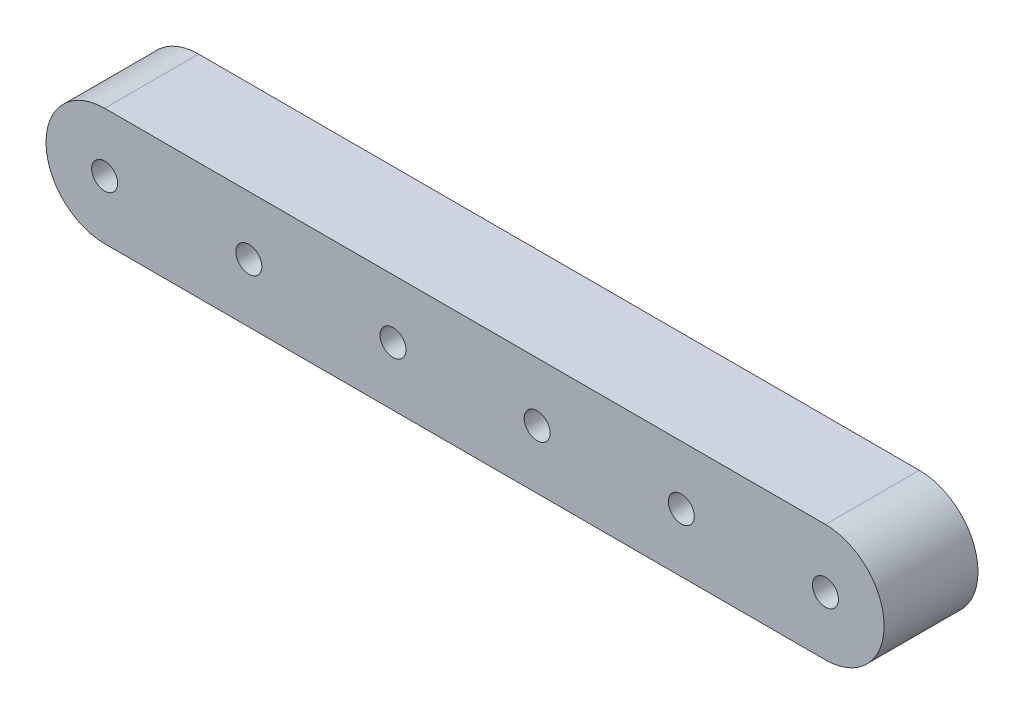
from build123d import *

# Parameters (mm, degrees)
BOSS_EXTRUDE1_DEPTH      = 2.8
BOSS_EXTRUDE1_DEPTH_BACK = 2.8
ECHELLE1_SCALE           = 2
SKETCH2_R                = 1.55
CUT_EXTRUDE6_DEPTH       = 11.2


with BuildPart() as part:
    # Sketch1 → Boss-Extrude1 (new, two sides: drawn at the far end of the back side and taken through both)
    with BuildSketch(Plane.XY.offset(-BOSS_EXTRUDE1_DEPTH_BACK)):
        with BuildLine():
            Line((-33.309608541, 3.5), (9.690391459, 3.5))
            ThreePointArc((9.690391459, 3.5), (13.190391459, 0), (9.690391459, -3.5))
            Line((9.690391459, -3.5), (-33.309608541, -3.5))
            ThreePointArc((-33.309608541, -3.5), (-36.809608541, 0), (-33.309608541, 3.5))
        make_face()
    extrude(amount=BOSS_EXTRUDE1_DEPTH + BOSS_EXTRUDE1_DEPTH_BACK)


with BuildPart() as part_1:
    # Echelle1: scaled about (-11.809608541, 0, 0)
    add(part.part.scale(ECHELLE1_SCALE).moved(Location((11.809608541, 0, 0))))

    # Sketch2 → Cut-Extrude6 (cut)
    with BuildSketch(Plane.XY.offset(-5.6)):
        with Locations((-54.809608541, 0)):
            Circle(SKETCH2_R)
        with Locations((-37.609608541, 0)):
            Circle(SKETCH2_R)
        with Locations((-20.409608541, 0)):
            Circle(SKETCH2_R)
        with Locations((-3.209608541, 0)):
            Circle(SKETCH2_R)
        with Locations((13.990391459, 0)):
            Circle(SKETCH2_R)
        with Locations((31.190391459, 0)):
            Circle(SKETCH2_R)
    extrude(amount=CUT_EXTRUDE6_DEPTH, mode=Mode.SUBTRACT)


solid = part_1.part
